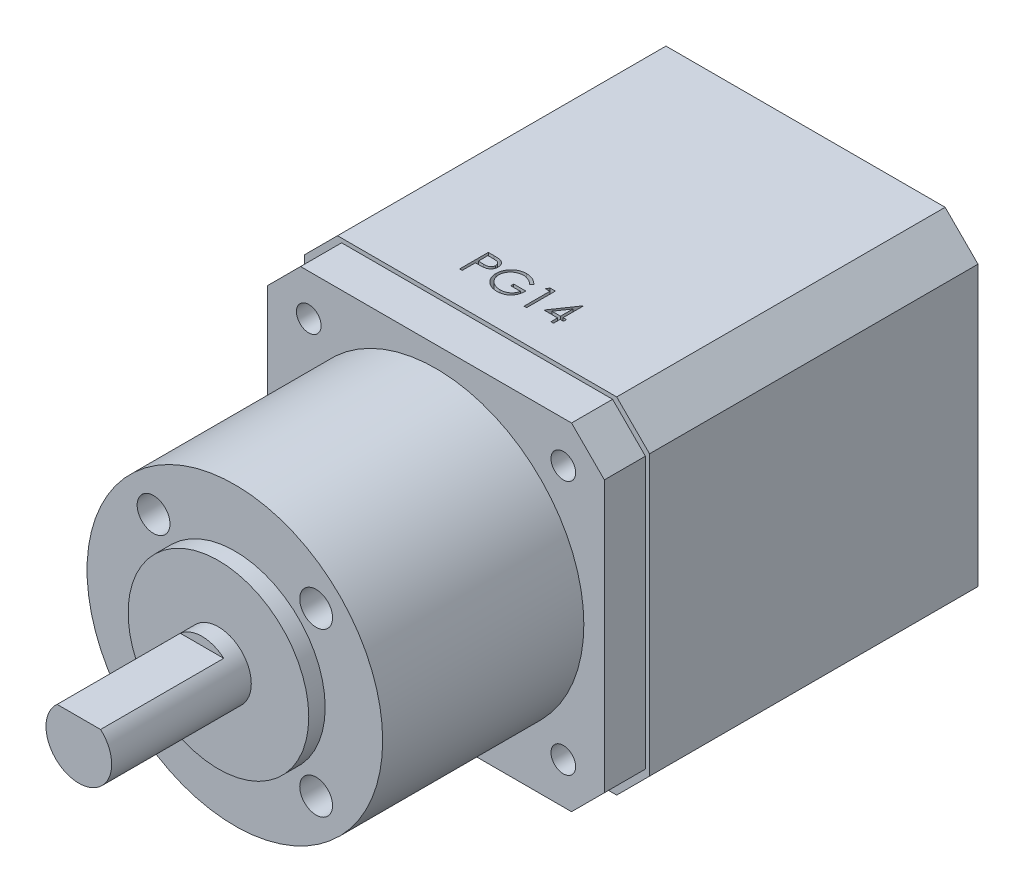
from build123d import *

# Parameters (mm, degrees)
SKETCH1_W           = 42
SKETCH1_H           = 42
BOSS_EXTRUDE1_DEPTH = 40
SKETCH2_W           = 41
SKETCH2_H           = 41
BOSS_EXTRUDE2_DEPTH = 5
SKETCH3_R           = 18
BOSS_EXTRUDE3_DEPTH = 24.5
SKETCH4_R           = 11
BOSS_EXTRUDE4_DEPTH = 2
SKETCH5_R           = 4
BOSS_EXTRUDE5_DEPTH = 17
CHAMFER1_SIZE       = 4
SKETCH6_R           = 1.5
CUT_EXTRUDE1_DEPTH  = 8
CIRPATTERN1_COUNT   = 4
SKETCH7_R           = 2
CUT_EXTRUDE2_DEPTH  = 8
CIRPATTERN2_COUNT   = 4
CUT_EXTRUDE3_START  = -15
CUT_EXTRUDE3_DEPTH  = 15
CUT_EXTRUDE4_DEPTH  = 10


with BuildPart() as part:
    # Sketch1 → Boss-Extrude1 (new body)
    with BuildSketch(Plane.XY):
        Rectangle(SKETCH1_W, SKETCH1_H)
    extrude(amount=BOSS_EXTRUDE1_DEPTH)

    # Sketch2 → Boss-Extrude2 (add)
    with BuildSketch(Plane.XY.offset(40)):
        Rectangle(SKETCH2_W, SKETCH2_H)
    extrude(amount=BOSS_EXTRUDE2_DEPTH)

    # Sketch3 → Boss-Extrude3 (add)
    with BuildSketch(Plane.XY.offset(45)):
        Circle(SKETCH3_R)
    extrude(amount=BOSS_EXTRUDE3_DEPTH)

    # Sketch4 → Boss-Extrude4 (add)
    with BuildSketch(Plane.XY.offset(69.5)):
        Circle(SKETCH4_R)
    extrude(amount=BOSS_EXTRUDE4_DEPTH)

    # Sketch5 → Boss-Extrude5 (add)
    with BuildSketch(Plane.XY.offset(71.5)):
        Circle(SKETCH5_R)
    extrude(amount=BOSS_EXTRUDE5_DEPTH)

    # Chamfer1
    chamfer1_edges = [part.edges().sort_by_distance(p)[0] for p in [
        (-20.5, -20.5, 42.5),
        (20.5, -20.5, 42.5),
        (20.5, 20.5, 42.5),
        (-20.5, 20.5, 42.5),
        (21, -21, 20),
        (-21, -21, 20),
        (-21, 21, 20),
        (21, 21, 20),
    ]]
    chamfer(chamfer1_edges, length=CHAMFER1_SIZE)

    # Sketch6 → Cut-Extrude1 (cut)
    with BuildSketch(Plane.XY.offset(45)):
        with Locations((15.5, 15.5)):
            Circle(SKETCH6_R)
    cut_extrude1 = extrude(amount=-CUT_EXTRUDE1_DEPTH, mode=Mode.SUBTRACT)

    # CirPattern1: Cut-Extrude1 ×4 about axis
    cirpattern1_axis = Axis((0, 0, 0), (0, 0, 1))
    for i in range(1, CIRPATTERN1_COUNT):
        add(cut_extrude1.rotate(cirpattern1_axis, i * 360 / CIRPATTERN1_COUNT), mode=Mode.SUBTRACT)

    # Sketch7 → Cut-Extrude2 (cut)
    with BuildSketch(Plane.XY.offset(69.5)):
        with Locations((9.899494937, 9.899494937)):
            Circle(SKETCH7_R)
    cut_extrude2 = extrude(amount=-CUT_EXTRUDE2_DEPTH, mode=Mode.SUBTRACT)

    # CirPattern2: Cut-Extrude2 ×4 about axis
    cirpattern2_axis = Axis((0, 0, 0), (0, 0, 1))
    for i in range(1, CIRPATTERN2_COUNT):
        add(cut_extrude2.rotate(cirpattern2_axis, i * 360 / CIRPATTERN2_COUNT), mode=Mode.SUBTRACT)

    # Sketch8 → Cut-Extrude3 (cut)
    with BuildSketch(Plane.XY.offset(88.5).offset(CUT_EXTRUDE3_START)):
        with BuildLine():
            Line((2.645751311, 3), (-2.645751311, 3))
            ThreePointArc((-2.645751311, 3), (0, 4), (2.645751311, 3))
        make_face()
    extrude(amount=CUT_EXTRUDE3_DEPTH, mode=Mode.SUBTRACT)

    # Sketch9 → Cut-Extrude4 (cut)
    # profile 1 of 4: a face of its own
    with BuildSketch(Plane(origin=(0, 21, 0), x_dir=(1, 0, 0), z_dir=(0, 1, 0))):
        with BuildLine():
            Line((-6.061143327, -32.575097759), (-5.37474509, -32.575097759))
            add(Edge.make_bspline(
                [(-5.37474509, -32.575097759), (-5.327534184, -32.575149656), (-5.237075991, -32.575249091), (-5.107360935, -32.578263837), (-4.989551204, -32.582290529), (-4.883900823, -32.587872422), (-4.790084724, -32.594469012), (-4.708527425, -32.603721052), (-4.638587869, -32.613381347), (-4.596681419, -32.623202754), (-4.577569609, -32.627681894)],
                knots=[0, 0, 0, 0, 1.415646017, 2.712440637, 3.8905458, 4.950247383, 5.884950622, 6.709939814, 7.411656543, 8, 8, 8, 8], degree=3))
            add(Edge.make_bspline(
                [(-4.577569609, -32.627681894), (-4.553376075, -32.634303844), (-4.505559098, -32.647391705), (-4.436658055, -32.673605429), (-4.371104209, -32.704687594), (-4.308672651, -32.740111534), (-4.250130568, -32.781397098), (-4.194604527, -32.826870716), (-4.142584547, -32.877582284), (-4.094363155, -32.932963024), (-4.050078357, -32.992083234), (-4.011948674, -33.055825464), (-3.980021447, -33.123116768), (-3.952638176, -33.193910339), (-3.932929721, -33.268800662), (-3.918082822, -33.347267375), (-3.908659194, -33.429302065), (-3.907756632, -33.485361932), (-3.907297173, -33.513899843)],
                knots=[0, 0, 0, 0, 0.999701418, 1.975846123, 2.934577507, 3.890451536, 4.834027766, 5.787354733, 6.749476667, 7.726910423, 8.712836071, 9.690891519, 10.682875813, 11.679750201, 12.712814741, 13.765529915, 14.8625177, 16, 16, 16, 16], degree=3))
            add(Edge.make_bspline(
                [(-3.907297173, -33.513899843), (-3.907718598, -33.542677619), (-3.908543144, -33.598983283), (-3.918439429, -33.681356072), (-3.931769621, -33.760074462), (-3.952266673, -33.834963912), (-3.979112346, -33.905579683), (-4.010604399, -33.973000915), (-4.048587929, -34.036080587), (-4.092232759, -34.095047704), (-4.140784354, -34.149957616), (-4.194037292, -34.200412411), (-4.251776584, -34.246116749), (-4.313818732, -34.287173093), (-4.380768581, -34.322629373), (-4.451610735, -34.354386677), (-4.526960951, -34.381057738), (-4.579103465, -34.3950878), (-4.605614481, -34.402221157)],
                knots=[0, 0, 0, 0, 1.121902311, 2.195077645, 3.232258892, 4.234102512, 5.217864754, 6.176164875, 7.132989551, 8.084763148, 9.034132444, 9.988522005, 10.94243251, 11.903244335, 12.886203696, 13.894208494, 14.929344452, 16, 16, 16, 16], degree=3))
            add(Edge.make_bspline(
                [(-4.605614481, -34.402221157), (-4.627541815, -34.406884138), (-4.675596842, -34.417103332), (-4.754739564, -34.428511789), (-4.84688495, -34.43824939), (-4.95190723, -34.445550527), (-5.069712135, -34.451800896), (-5.200363392, -34.456768989), (-5.34411747, -34.459498843), (-5.444388714, -34.459639636), (-5.496740282, -34.459713144)],
                knots=[0, 0, 0, 0, 0.601384939, 1.31797006, 2.144135048, 3.087295005, 4.142315834, 5.309527816, 6.595305764, 8, 8, 8, 8], degree=3))
            Line((-5.496740282, -34.459713144), (-5.747040763, -34.459713144))
            Line((-5.747040763, -34.459713144), (-5.747040763, -36.075097759))
            Line((-5.747040763, -36.075097759), (-6.061143327, -36.075097759))
            Line((-6.061143327, -36.075097759), (-6.061143327, -32.575097759))
        make_face()
        with BuildLine():
            Line((-5.747040763, -32.934072118), (-5.747040763, -34.100738785))
            Line((-5.747040763, -34.100738785), (-5.134260314, -34.108451125))
            add(Edge.make_bspline(
                [(-5.134260314, -34.108451125), (-5.104340388, -34.108466588), (-5.046580588, -34.10849644), (-4.963144365, -34.104511217), (-4.885735078, -34.099910684), (-4.814590503, -34.093174761), (-4.749678568, -34.083653503), (-4.690891039, -34.074041765), (-4.638683756, -34.060136403), (-4.577584554, -34.041413334), (-4.509501207, -34.009480718), (-4.435433658, -33.963130828), (-4.372663072, -33.90405012), (-4.318344775, -33.837622288), (-4.275238897, -33.763723159), (-4.243682905, -33.684654222), (-4.225141748, -33.601226373), (-4.222655554, -33.544138234), (-4.221399737, -33.515302086)],
                knots=[0, 0, 0, 0, 1.160613943, 2.240541288, 3.23993089, 4.169200891, 5.011653406, 5.7853311, 6.478053781, 7.106038997, 8.262395093, 9.384106736, 10.481365981, 11.59014053, 12.70357646, 13.786202915, 14.881775077, 16, 16, 16, 16], degree=3))
            add(Edge.make_bspline(
                [(-4.221399737, -33.515302086), (-4.222662384, -33.487163573), (-4.225172369, -33.431227691), (-4.243828232, -33.34924893), (-4.275177546, -33.271013226), (-4.31863414, -33.19804014), (-4.37137527, -33.131851336), (-4.432674613, -33.074354209), (-4.502387875, -33.028132507), (-4.567236106, -32.998299225), (-4.624837292, -32.980083949), (-4.674869252, -32.967339109), (-4.731359926, -32.957163503), (-4.794327706, -32.948924), (-4.863284539, -32.941870539), (-4.938822854, -32.937084562), (-5.020656498, -32.934283105), (-5.077467068, -32.93414415), (-5.106916564, -32.934072118)],
                knots=[0, 0, 0, 0, 1.120700087, 2.227813068, 3.331159281, 4.466773991, 5.599788987, 6.693661531, 7.80175334, 8.91857717, 9.525282508, 10.207424825, 10.974604443, 11.810962634, 12.737642355, 13.736264703, 14.826523623, 16, 16, 16, 16], degree=3))
            Line((-5.106916564, -32.934072118), (-5.747040763, -32.934072118))
        make_face(mode=Mode.SUBTRACT)
    # profile 2 of 4: a face of its own
    with BuildSketch(Plane(origin=(0, 21, 0), x_dir=(1, 0, 0), z_dir=(0, 1, 0))):
        with BuildLine():
            Line((0.08629257, -33.172453529), (-0.182938199, -33.427661862))
            add(Edge.make_bspline(
                [(-0.182938199, -33.427661862), (-0.231657087, -33.381830999), (-0.327933133, -33.291262136), (-0.484893376, -33.173751141), (-0.64865701, -33.073085041), (-0.818369507, -32.991178804), (-0.989828061, -32.925826044), (-1.160756837, -32.879297904), (-1.329402538, -32.849625366), (-1.441569757, -32.846076997), (-1.496840442, -32.844328529)],
                knots=[0, 0, 0, 0, 1.08915593, 2.152340314, 3.188132944, 4.216796309, 5.218260357, 6.173443236, 7.099959455, 8, 8, 8, 8], degree=3))
            add(Edge.make_bspline(
                [(-1.496840442, -32.844328529), (-1.530755142, -32.844742134), (-1.598496583, -32.845568274), (-1.699118527, -32.856112489), (-1.798685164, -32.871277353), (-1.897008539, -32.893219231), (-1.994279825, -32.92102829), (-2.090160717, -32.955813753), (-2.184830072, -32.996368998), (-2.277396153, -33.043231471), (-2.367136657, -33.094711318), (-2.451893492, -33.151759858), (-2.532206891, -33.212548648), (-2.606567316, -33.278599628), (-2.675402503, -33.349314493), (-2.740350875, -33.423377799), (-2.799128171, -33.502813018), (-2.852219336, -33.586158644), (-2.899580954, -33.671950833), (-2.941389608, -33.759363823), (-2.976486696, -33.848107677), (-3.004256151, -33.938293755), (-3.027166805, -34.029224345), (-3.043284412, -34.121529065), (-3.052371135, -34.21530675), (-3.053942915, -34.278104009), (-3.054733071, -34.30967308)],
                knots=[0, 0, 0, 0, 1.02818874, 2.053710826, 3.065248034, 4.081641283, 5.106893873, 6.131558223, 7.173050175, 8.228653731, 9.27666206, 10.308777013, 11.325269123, 12.329503258, 13.32196095, 14.316845687, 15.314881793, 16.315733098, 17.311955233, 18.285320748, 19.252783886, 20.203351036, 21.145449891, 22.095197417, 23.042428769, 24, 24, 24, 24], degree=3))
            add(Edge.make_bspline(
                [(-3.054733071, -34.30967308), (-3.053977352, -34.341943897), (-3.052467979, -34.406397411), (-3.04280766, -34.502591483), (-3.024879419, -34.597356886), (-3.000911711, -34.691005019), (-2.970930895, -34.783696267), (-2.933558229, -34.875028776), (-2.889292628, -34.964999168), (-2.838056076, -35.052796785), (-2.781869873, -35.138319808), (-2.718926792, -35.21887933), (-2.652066208, -35.295548107), (-2.578852308, -35.366623871), (-2.501632766, -35.434007767), (-2.41810049, -35.495843289), (-2.32989803, -35.553321512), (-2.236890818, -35.605718032), (-2.140088035, -35.652526567), (-2.040831282, -35.694150463), (-1.938803467, -35.728429801), (-1.834540777, -35.756367905), (-1.728167505, -35.779268202), (-1.619143703, -35.794000682), (-1.508270994, -35.804691513), (-1.433532362, -35.805473183), (-1.395878904, -35.80586699)],
                knots=[0, 0, 0, 0, 0.93586088, 1.869166235, 2.799637598, 3.729985548, 4.670839027, 5.622275134, 6.589130586, 7.576015415, 8.568469353, 9.55398029, 10.53834874, 11.515998671, 12.510579167, 13.508179873, 14.527009472, 15.561807829, 16.601455013, 17.643573243, 18.680854198, 19.719860599, 20.772568776, 21.833555941, 22.908541556, 24, 24, 24, 24], degree=3))
            add(Edge.make_bspline(
                [(-1.395878904, -35.80586699), (-1.350500557, -35.804918414), (-1.261392799, -35.80305573), (-1.130406357, -35.788555441), (-1.004603286, -35.765908647), (-0.884337083, -35.73274275), (-0.769468062, -35.690439075), (-0.659575121, -35.639443689), (-0.555523462, -35.57780063), (-0.457000288, -35.508226763), (-0.366243103, -35.43071193), (-0.284388979, -35.347067475), (-0.21274349, -35.257699408), (-0.15023879, -35.163134093), (-0.098530136, -35.062588788), (-0.056087341, -34.956556226), (-0.023554049, -34.844988714), (-0.010199075, -34.767897082), (-0.003451019, -34.728943913)],
                knots=[0, 0, 0, 0, 1.13008108, 2.219097802, 3.278683437, 4.311054135, 5.322181354, 6.324827112, 7.324222904, 8.330512327, 9.32562643, 10.293043162, 11.24128371, 12.174520618, 13.111833804, 14.052305215, 15.015860969, 16, 16, 16, 16], degree=3))
            Line((-0.003451019, -34.728943913), (-1.170117686, -34.728943913))
            Line((-1.170117686, -34.728943913), (-1.170117686, -34.369969554))
            Line((-1.170117686, -34.369969554), (0.310651545, -34.369969554))
            add(Edge.make_bspline(
                [(0.310651545, -34.369969554), (0.308945696, -34.436877043), (0.305607043, -34.567827085), (0.282188127, -34.758797356), (0.244371615, -34.939169049), (0.192711303, -35.109132121), (0.125836023, -35.268445713), (0.044463494, -35.417271579), (-0.052708627, -35.55464826), (-0.162219068, -35.681697264), (-0.285119026, -35.795026476), (-0.418087646, -35.894632414), (-0.561344614, -35.978535029), (-0.714754422, -36.046795692), (-0.877814855, -36.100069687), (-1.050903235, -36.137841263), (-1.233784836, -36.160471227), (-1.359121512, -36.163362606), (-1.423222654, -36.164841349)],
                knots=[0, 0, 0, 0, 1.140356446, 2.231883559, 3.274166699, 4.278491846, 5.25512956, 6.21435461, 7.1637429, 8.11826594, 9.068280886, 10.0076534, 10.945064095, 11.891975133, 12.864533718, 13.863980011, 14.907571808, 16, 16, 16, 16], degree=3))
            add(Edge.make_bspline(
                [(-1.423222654, -36.164841349), (-1.462732789, -36.164272228), (-1.54065951, -36.163149737), (-1.655750438, -36.15517239), (-1.767668059, -36.142891814), (-1.876396068, -36.12434669), (-1.98233441, -36.101632036), (-2.084953995, -36.072545317), (-2.184645737, -36.038876618), (-2.281563722, -36.000580944), (-2.374828269, -35.956209288), (-2.464854786, -35.906899648), (-2.552140912, -35.852906287), (-2.636092077, -35.793295442), (-2.717145698, -35.728512982), (-2.794779142, -35.658429063), (-2.86942702, -35.583257943), (-2.916187484, -35.529878933), (-2.939749096, -35.502982375)],
                knots=[0, 0, 0, 0, 1.107784379, 2.184907829, 3.233506516, 4.263428166, 5.276301166, 6.270063455, 7.25232949, 8.225834625, 9.190232166, 10.146266622, 11.1027726, 12.066435141, 13.031522626, 14.010570082, 14.99756817, 16, 16, 16, 16], degree=3))
            add(Edge.make_bspline(
                [(-2.939749096, -35.502982375), (-2.973935028, -35.460311722), (-3.041739441, -35.375678705), (-3.129017597, -35.24007876), (-3.203419, -35.0996769), (-3.263786822, -34.954082272), (-3.310924909, -34.803431059), (-3.344731161, -34.647915768), (-3.364538451, -34.487336137), (-3.367391988, -34.378670872), (-3.368835635, -34.323695516)],
                knots=[0, 0, 0, 0, 1.023165419, 2.029347347, 3.013907458, 3.994755782, 4.975994455, 5.96558838, 6.970761222, 8, 8, 8, 8], degree=3))
            add(Edge.make_bspline(
                [(-3.368835635, -34.323695516), (-3.368303397, -34.282529263), (-3.367245685, -34.200719956), (-3.354420169, -34.079262648), (-3.336018751, -33.959961956), (-3.308971696, -33.8429154), (-3.274875431, -33.728044808), (-3.232321945, -33.615296844), (-3.182777049, -33.504604972), (-3.125191553, -33.396731104), (-3.061107094, -33.293106692), (-2.991556873, -33.194148888), (-2.915553273, -33.101659823), (-2.834337474, -33.014468175), (-2.746940483, -32.933669328), (-2.65418106, -32.858515217), (-2.555987717, -32.788905032), (-2.452051537, -32.725935197), (-2.343923852, -32.669371576), (-2.231863851, -32.619782365), (-2.11590574, -32.578799049), (-1.996918262, -32.54402527), (-1.874000762, -32.518310129), (-1.748045225, -32.499661384), (-1.618395113, -32.486900784), (-1.530759083, -32.485874528), (-1.486323615, -32.48535417)],
                knots=[0, 0, 0, 0, 1.008945113, 2.00506715, 2.99143336, 3.967273523, 4.948097931, 5.927297278, 6.919902385, 7.919676788, 8.923139349, 9.905703106, 10.883022732, 11.856032218, 12.825136022, 13.798837087, 14.781400844, 15.773989409, 16.776158564, 17.77167057, 18.775803737, 19.789618931, 20.80898985, 21.851988756, 22.910860228, 24, 24, 24, 24], degree=3))
            add(Edge.make_bspline(
                [(-1.486323615, -32.48535417), (-1.450085372, -32.485933661), (-1.378229193, -32.487082725), (-1.271303461, -32.495047373), (-1.166030446, -32.507671255), (-1.062254056, -32.524898041), (-0.96032769, -32.548361732), (-0.859960985, -32.576440016), (-0.761008448, -32.609131839), (-0.663780199, -32.648120685), (-0.567622483, -32.69237431), (-0.472000643, -32.742187733), (-0.377241397, -32.798412737), (-0.283180415, -32.861216273), (-0.189224557, -32.929519691), (-0.096859915, -33.005276514), (-0.003856971, -33.08549927), (0.055944843, -33.143181454), (0.08629257, -33.172453529)],
                knots=[0, 0, 0, 0, 0.985871117, 1.954866573, 2.915460327, 3.869826059, 4.81536089, 5.759505086, 6.70452669, 7.649098992, 8.607881297, 9.583363685, 10.581137262, 11.603961102, 12.659522466, 13.73993555, 14.853081303, 16, 16, 16, 16], degree=3))
        make_face()
    # profile 3 of 4: a face of its own
    with BuildSketch(Plane(origin=(0, 21, 0), x_dir=(1, 0, 0), z_dir=(0, 1, 0))):
        Polygon((1.458387923, -32.575097759), (2.10552334, -32.575097759), (2.10552334, -36.075097759), (1.791420776, -36.075097759), (1.791420776, -32.934072118), (1.252959237, -32.934072118), align=None)
    # profile 4 of 4: a face of its own
    with BuildSketch(Plane(origin=(0, 21, 0), x_dir=(1, 0, 0), z_dir=(0, 1, 0))):
        Polygon((5.317362282, -32.48535417), (5.381164365, -32.48535417), (5.381164365, -34.908431093), (5.785010519, -34.908431093), (5.785010519, -35.267405452), (5.381164365, -35.267405452), (5.381164365, -36.075097759), (5.067061801, -36.075097759), (5.067061801, -35.267405452), (3.406805391, -35.267405452), align=None)
        Polygon((5.067061801, -34.908431093), (5.067061801, -33.388399041), (4.02379257, -34.908431093), align=None, mode=Mode.SUBTRACT)
    extrude(amount=-CUT_EXTRUDE4_DEPTH, mode=Mode.SUBTRACT)


solid = part.part
